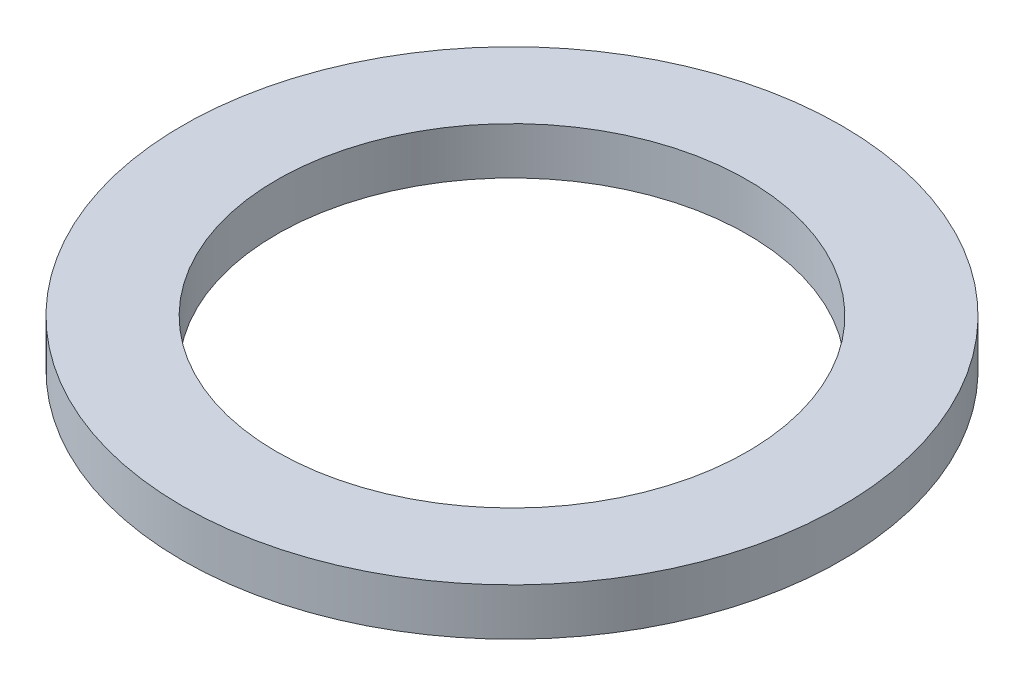
from build123d import *

# Parameters (mm, degrees)
SKETCH1_R           = 35
SKETCH1_R_2         = 25
BOSS_EXTRUDE1_DEPTH = 5


with BuildPart() as part:
    # Sketch1 → Boss-Extrude1 (new body)
    with BuildSketch(Plane(origin=(0, 0, 0), x_dir=(1, 0, 0), z_dir=(0, 1, 0))):
        with Locations(Location((0, 0, 0), (0, 0, 270))):
            Circle(SKETCH1_R)
        with Locations(Location((0, 0, 0), (0, 0, 270))):
            Circle(SKETCH1_R_2, mode=Mode.SUBTRACT)
    extrude(amount=BOSS_EXTRUDE1_DEPTH)


solid = part.part
